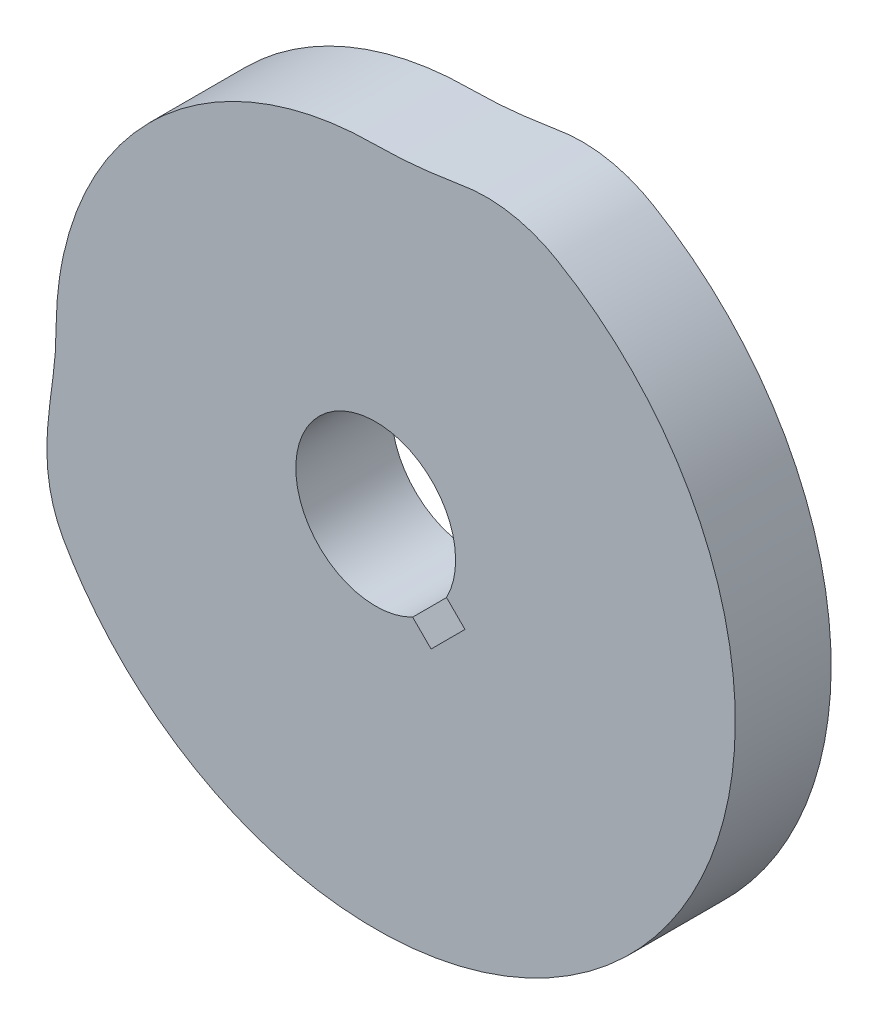
from build123d import *

# Parameters (mm, degrees)
EXTRUDE_1_DEPTH          = 12
CUT_EXTRUDE_1_DEPTH      = 12
CUT_EXTRUDE_1_DEPTH_BACK = 12


with BuildPart() as part:
    # 草图1 → 凸台-拉伸1 (new body)
    with BuildSketch(Plane.XY):
        with BuildLine():
            add(Edge.make_bspline(
                [(-39.585218855, 5.745471971), (-36.944936745, 23.936518014), (-23.949412425, 36.936579298), (-5.759289098, 39.58321095), (-4.493034432, 39.767448825), (-1.942843962, 40.014403292), (1.90852667, 39.986323878), (4.460941379, 40.186002627), (5.733272252, 40.322085771), (5.955022815, 40.345803276), (6.423833931, 40.398300747), (7.14241504, 40.485813751), (7.892721613, 40.584291583), (8.653241562, 40.690501104), (9.424776334, 40.804477568), (10.208482371, 40.924032351), (11.001050108, 41.054818025), (11.801394045, 41.17019302), (12.6062452, 41.243766285), (13.410182975, 41.281978357), (14.212080815, 41.283213296), (15.010466504, 41.248169958), (15.803971804, 41.176986285), (16.591214196, 41.070005065), (17.370829939, 40.927569381), (18.141466772, 40.750076698), (18.901787355, 40.537963882), (19.650469901, 40.291710786), (20.386209249, 40.01183821), (20.968667488, 39.759218144), (21.30535302, 39.599993598), (21.404665407, 39.551850614), (21.525670083, 39.493192009), (21.766302004, 39.373033347), (22.12433122, 39.186326932), (22.357935356, 39.05305122), (22.474436383, 38.985891156), (22.600346623, 38.913306906), (22.85146384, 38.766918474), (23.226033937, 38.543672829), (23.474267332, 38.392445808), (23.598014818, 38.316232808), (50.618136373, 21.675211964), (54.174008838, -9.858362438), (31.538341417, -32.098800922), (8.902673996, -54.339239407), (-22.563379883, -50.228522095), (-38.725917783, -22.91949589), (-38.755045843, -22.870279675), (-38.813114317, -22.771736189), (-38.899654239, -22.623587517), (-38.956969601, -22.524604106), (-38.985532831, -22.47505795), (-39.010106366, -22.432432372), (-39.059113619, -22.347100611), (-39.130334183, -22.217784831), (-39.177258062, -22.131288716), (-39.200506712, -22.087926304), (-39.373731502, -21.764834653), (-39.650574877, -21.199700468), (-39.992621915, -20.376017136), (-40.257783821, -19.63349279), (-40.486486905, -18.877402437), (-40.679361932, -18.109737008), (-40.837361899, -17.332519034), (-40.961753286, -16.547773026), (-41.054099487, -15.757495319), (-41.116241221, -14.963625441), (-41.150273012, -14.168018898), (-41.158516391, -13.372421843), (-41.143490093, -12.578447889), (-41.107877608, -11.787557387), (-41.054492529, -11.00103945), (-40.986242095, -10.219996969), (-40.906089421, -9.445334879), (-40.817014905, -8.677751836), (-40.721977304, -7.917735488), (-40.623874999, -7.165561423), (-40.526826925, -6.43127548), (-40.463783118, -5.947589656), (-40.433671769, -5.712000374), (-40.27183029, -4.445762926), (-39.981986588, -1.908962939), (-40.014343546, 1.938013732), (-39.768576726, 4.482170808), (-39.585218855, 5.745471971)],
                knots=[0, 0, 0, 0, 0.192336429, 0.192336429, 0.192336429, 0.207768076, 0.223199723, 0.23863137, 0.23863137, 0.23863137, 0.241320903, 0.244320439, 0.247361288, 0.250447034, 0.253581132, 0.256766907, 0.260007556, 0.26326894, 0.266516144, 0.269750259, 0.272972355, 0.276183492, 0.279384713, 0.282577047, 0.285761515, 0.288939122, 0.292110868, 0.295277741, 0.298440726, 0.301600798, 0.302931689, 0.302931689, 0.302931689, 0.30455328, 0.30617487, 0.307796461, 0.307796461, 0.307796461, 0.30954902, 0.311301578, 0.313054137, 0.313054137, 0.313054137, 0.597889801, 0.597889801, 0.597889801, 0.882725466, 0.882725466, 0.882725466, 0.883415111, 0.884104756, 0.884794401, 0.884794401, 0.884794401, 0.885387716, 0.885981032, 0.886574347, 0.886574347, 0.886574347, 0.890995119, 0.894157961, 0.897325907, 0.900500017, 0.903680851, 0.906868386, 0.910061983, 0.913260364, 0.916461635, 0.919663327, 0.922862469, 0.926055684, 0.929239298, 0.932409478, 0.935562364, 0.938694227, 0.941801616, 0.944881514, 0.947931482, 0.950949795, 0.953814157, 0.953814157, 0.953814157, 0.969209438, 0.984604719, 1, 1, 1, 1], degree=3, weights=[1, 0.867630243, 0.867630243, 1, 1, 1, 1, 1, 1, 1, 1, 1, 1, 1, 1, 1, 1, 1, 1, 1, 1, 1, 1, 1, 1, 1, 1, 1, 1, 1, 1, 1, 1, 1, 1, 1, 1, 1, 1, 1, 1, 1, 0.744339275, 0.744339275, 1, 0.744339275, 0.744339275, 1, 1, 1, 1, 1, 1, 1, 1, 1, 1, 1, 1, 1, 1, 1, 1, 1, 1, 1, 1, 1, 1, 1, 1, 1, 1, 1, 1, 1, 1, 1, 1, 1, 1, 1, 1, 1, 1, 1]))
        make_face()
    extrude(amount=EXTRUDE_1_DEPTH)

    # 草图2 → 切除-拉伸1 (cut, two sides: drawn at the far end of the back side and taken through both)
    with BuildSketch(Plane.XY.offset(-CUT_EXTRUDE_1_DEPTH_BACK)):
        with BuildLine():
            Line((8.866689125, -4.624048438), (11.172287109, -6.929646422))
            Line((11.172287109, -6.929646422), (6.929646422, -11.172287109))
            Line((6.929646422, -11.172287109), (4.624048438, -8.866689125))
            ThreePointArc((4.624048438, -8.866689125), (-7.071067812, 7.071067812), (8.866689125, -4.624048438))
        make_face()
    extrude(amount=CUT_EXTRUDE_1_DEPTH + CUT_EXTRUDE_1_DEPTH_BACK, mode=Mode.SUBTRACT)


solid = part.part
